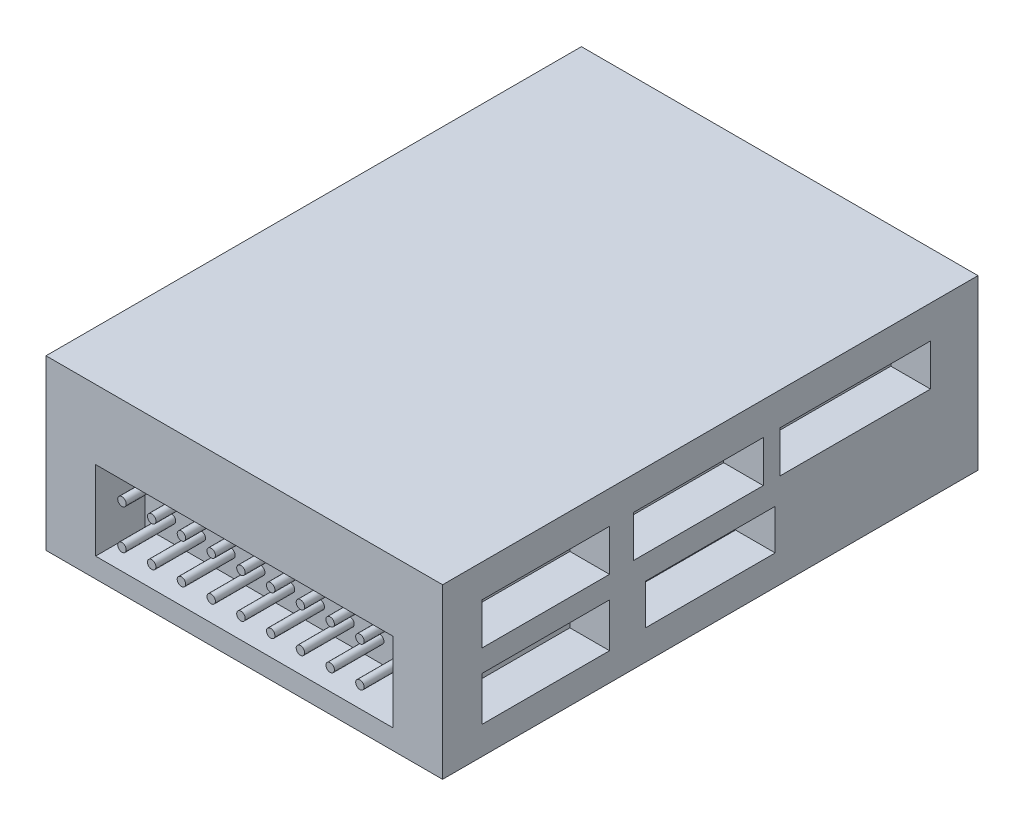
from build123d import *

# Parameters (mm, degrees)
SKETCH1_W           = 40
SKETCH1_H           = 54
BOSS_EXTRUDE1_DEPTH = 17
SKETCH2_W           = 30
SKETCH2_H           = 8
SKETCH2_R           = 0.426133687
CUT_EXTRUDE1_DEPTH  = 5
SKETCH3_W           = 12.848601187
SKETCH3_H           = 4.200504235
SKETCH3_W_2         = 13.095689671
SKETCH3_W_3         = 15.195941788
SKETCH3_H_2         = 4.447592718
SKETCH3_W_4         = 13.095689672
SKETCH3_H_3         = 4.076959992
CUT_EXTRUDE2_DEPTH  = 4


with BuildPart() as part:
    # Sketch1 → Boss-Extrude1 (new body)
    with BuildSketch(Plane(origin=(0, 0, 0), x_dir=(1, 0, 0), z_dir=(0, 1, 0))):
        Rectangle(SKETCH1_W, SKETCH1_H)
    extrude(amount=BOSS_EXTRUDE1_DEPTH)

    # Sketch2 → Cut-Extrude1 (cut)
    with BuildSketch(Plane.XY.offset(27)):
        with Locations((0, 6)):
            Rectangle(SKETCH2_W, SKETCH2_H)
        with Locations((-12.339715026, 8.094368166)):
            Circle(SKETCH2_R, mode=Mode.SUBTRACT)
        with Locations((-9.339715026, 8.094368166)):
            Circle(SKETCH2_R, mode=Mode.SUBTRACT)
        with Locations((-6.339715026, 8.094368166)):
            Circle(SKETCH2_R, mode=Mode.SUBTRACT)
        with Locations((-3.339715026, 8.094368166)):
            Circle(SKETCH2_R, mode=Mode.SUBTRACT)
        with Locations((-0.339715026, 8.094368166)):
            Circle(SKETCH2_R, mode=Mode.SUBTRACT)
        with Locations((2.660284974, 8.094368166)):
            Circle(SKETCH2_R, mode=Mode.SUBTRACT)
        with Locations((5.660284974, 8.094368166)):
            Circle(SKETCH2_R, mode=Mode.SUBTRACT)
        with Locations((8.660284974, 8.094368166)):
            Circle(SKETCH2_R, mode=Mode.SUBTRACT)
        with Locations((11.660284974, 8.094368166)):
            Circle(SKETCH2_R, mode=Mode.SUBTRACT)
        with Locations((-9.339715026, 4.094368166)):
            Circle(SKETCH2_R, mode=Mode.SUBTRACT)
        with Locations((-6.339715026, 4.094368166)):
            Circle(SKETCH2_R, mode=Mode.SUBTRACT)
        with Locations((-3.339715026, 4.094368166)):
            Circle(SKETCH2_R, mode=Mode.SUBTRACT)
        with Locations((-0.339715026, 4.094368166)):
            Circle(SKETCH2_R, mode=Mode.SUBTRACT)
        with Locations((2.660284974, 4.094368166)):
            Circle(SKETCH2_R, mode=Mode.SUBTRACT)
        with Locations((5.660284974, 4.094368166)):
            Circle(SKETCH2_R, mode=Mode.SUBTRACT)
        with Locations((8.660284974, 4.094368166)):
            Circle(SKETCH2_R, mode=Mode.SUBTRACT)
        with Locations((11.660284974, 4.094368166)):
            Circle(SKETCH2_R, mode=Mode.SUBTRACT)
        with Locations((-12.339715026, 4.094368166)):
            Circle(SKETCH2_R, mode=Mode.SUBTRACT)
    extrude(amount=-CUT_EXTRUDE1_DEPTH, mode=Mode.SUBTRACT)

    # Sketch3 → Cut-Extrude2 (cut)
    with BuildSketch(Plane(origin=(20, 0, 0), x_dir=(0, 0, -1), z_dir=(1, 0, 0))):
        with Locations((-16.585814513, 11.588606055)):
            Rectangle(SKETCH3_W, SKETCH3_H)
        with Locations((-1.204556361, 11.588606055)):
            Rectangle(SKETCH3_W_2, SKETCH3_H)
        with Locations((14.609106638, 11.588606055)):
            Rectangle(SKETCH3_W_3, SKETCH3_H)
        with Locations((-16.585814513, 5.040761219)):
            Rectangle(SKETCH3_W, SKETCH3_H_2)
        with Locations((0, 5.040761219)):
            Rectangle(SKETCH3_W_4, SKETCH3_H_3)
    extrude(amount=-CUT_EXTRUDE2_DEPTH, mode=Mode.SUBTRACT)


solid = part.part
